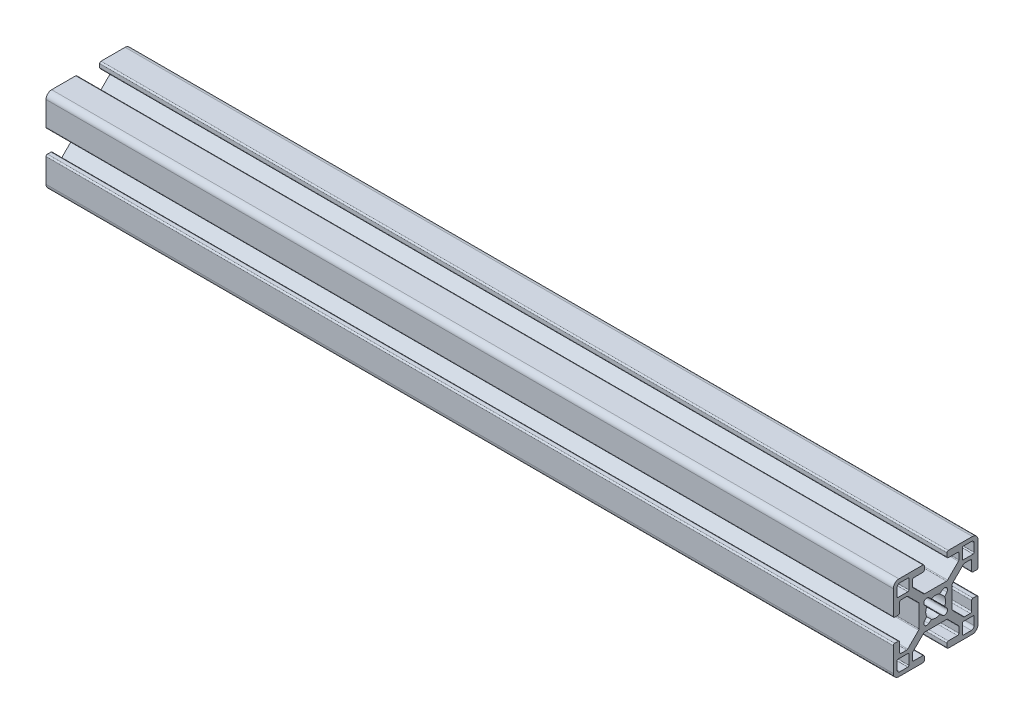
from build123d import *

# Parameters (mm, degrees)
PERFIL_COM_ALUMINIO_PERFIL_COMER_30_X_DEPTH = 300


with BuildPart() as part:
    # Esboço11 → Perfil com. aluminio PERFIL COMER. 30 X 30(1) (new body)
    with BuildSketch(Plane(origin=(0, 0, 0), x_dir=(0, 0, -1), z_dir=(1, 0, 0))):
        with BuildLine():
            Line((0, 5.872725395), (-3.872893219, 5.872725395))
            ThreePointArc((-3.872893219, 5.872725395), (-4.064234935, 5.910785628), (-4.226446609, 6.019172004))
            Line((-4.226446609, 6.019172004), (-8.073553391, 9.866278785))
            ThreePointArc((-8.073553391, 9.866278785), (-8.181939766, 10.02849046), (-8.22, 10.219832176))
            Line((-8.22, 10.219832176), (-8.22, 12.25))
            ThreePointArc((-8.22, 12.25), (-8.073553391, 12.603553391), (-7.72, 12.75))
            Line((-7.72, 12.75), (-4.5, 12.75))
            ThreePointArc((-4.5, 12.75), (-4.146446609, 12.896446609), (-4, 13.25))
            Line((-4, 13.25), (-4, 14.5))
            ThreePointArc((-4, 14.5), (-4.146446609, 14.853553391), (-4.5, 15))
            Line((-4.5, 15), (-13, 15))
            ThreePointArc((-13, 15), (-14.414213562, 14.414213562), (-15, 13))
            Line((-15, 13), (-15, 4.5))
            ThreePointArc((-15, 4.5), (-14.853553391, 4.146446609), (-14.5, 4))
            Line((-14.5, 4), (-13.25, 4))
            ThreePointArc((-13.25, 4), (-12.896446609, 4.146446609), (-12.75, 4.5))
            Line((-12.75, 4.5), (-12.75, 7.72))
            ThreePointArc((-12.75, 7.72), (-12.603553391, 8.073553391), (-12.25, 8.22))
            Line((-12.25, 8.22), (-10.219832176, 8.22))
            ThreePointArc((-10.219832176, 8.22), (-10.02849046, 8.181939766), (-9.866278785, 8.073553391))
            Line((-9.866278785, 8.073553391), (-6.019172004, 4.226446609))
            ThreePointArc((-6.019172004, 4.226446609), (-5.910785628, 4.064234935), (-5.872725395, 3.872893219))
            Line((-5.872725395, 3.872893219), (-5.872725395, 0))
            Line((-5.872725395, 0), (-5.872725395, -3.872893219))
            ThreePointArc((-5.872725395, -3.872893219), (-5.910785628, -4.064234935), (-6.019172004, -4.226446609))
            Line((-6.019172004, -4.226446609), (-9.866278785, -8.073553391))
            ThreePointArc((-9.866278785, -8.073553391), (-10.02849046, -8.181939766), (-10.219832176, -8.22))
            Line((-10.219832176, -8.22), (-12.25, -8.22))
            ThreePointArc((-12.25, -8.22), (-12.603553391, -8.073553391), (-12.75, -7.72))
            Line((-12.75, -7.72), (-12.75, -4.5))
            ThreePointArc((-12.75, -4.5), (-12.896446609, -4.146446609), (-13.25, -4))
            Line((-13.25, -4), (-14.5, -4))
            ThreePointArc((-14.5, -4), (-14.853553391, -4.146446609), (-15, -4.5))
            Line((-15, -4.5), (-15, -13))
            ThreePointArc((-15, -13), (-14.414213562, -14.414213562), (-13, -15))
            Line((-13, -15), (-4.5, -15))
            ThreePointArc((-4.5, -15), (-4.146446609, -14.853553391), (-4, -14.5))
            Line((-4, -14.5), (-4, -13.25))
            ThreePointArc((-4, -13.25), (-4.146446609, -12.896446609), (-4.5, -12.75))
            Line((-4.5, -12.75), (-7.72, -12.75))
            ThreePointArc((-7.72, -12.75), (-8.073553391, -12.603553391), (-8.22, -12.25))
            Line((-8.22, -12.25), (-8.22, -10.219832176))
            ThreePointArc((-8.22, -10.219832176), (-8.181939766, -10.02849046), (-8.073553391, -9.866278785))
            Line((-8.073553391, -9.866278785), (-4.226446609, -6.019172004))
            ThreePointArc((-4.226446609, -6.019172004), (-4.064234935, -5.910785628), (-3.872893219, -5.872725395))
            Line((-3.872893219, -5.872725395), (0, -5.872725395))
            Line((0, -5.872725395), (3.872893219, -5.872725395))
            ThreePointArc((3.872893219, -5.872725395), (4.064234935, -5.910785628), (4.226446609, -6.019172004))
            Line((4.226446609, -6.019172004), (8.073553391, -9.866278785))
            ThreePointArc((8.073553391, -9.866278785), (8.181939766, -10.02849046), (8.22, -10.219832176))
            Line((8.22, -10.219832176), (8.22, -12.25))
            ThreePointArc((8.22, -12.25), (8.073553391, -12.603553391), (7.72, -12.75))
            Line((7.72, -12.75), (4.5, -12.75))
            ThreePointArc((4.5, -12.75), (4.146446609, -12.896446609), (4, -13.25))
            Line((4, -13.25), (4, -14.5))
            ThreePointArc((4, -14.5), (4.146446609, -14.853553391), (4.5, -15))
            Line((4.5, -15), (13, -15))
            ThreePointArc((13, -15), (14.414213562, -14.414213562), (15, -13))
            Line((15, -13), (15, -4.5))
            ThreePointArc((15, -4.5), (14.853553391, -4.146446609), (14.5, -4))
            Line((14.5, -4), (13.25, -4))
            ThreePointArc((13.25, -4), (12.896446609, -4.146446609), (12.75, -4.5))
            Line((12.75, -4.5), (12.75, -7.72))
            ThreePointArc((12.75, -7.72), (12.603553391, -8.073553391), (12.25, -8.22))
            Line((12.25, -8.22), (10.219832176, -8.22))
            ThreePointArc((10.219832176, -8.22), (10.02849046, -8.181939766), (9.866278785, -8.073553391))
            Line((9.866278785, -8.073553391), (6.019172004, -4.226446609))
            ThreePointArc((6.019172004, -4.226446609), (5.910785628, -4.064234935), (5.872725395, -3.872893219))
            Line((5.872725395, -3.872893219), (5.872725395, 0))
            Line((5.872725395, 0), (5.872725395, 3.872893219))
            ThreePointArc((5.872725395, 3.872893219), (5.910785628, 4.064234935), (6.019172004, 4.226446609))
            Line((6.019172004, 4.226446609), (9.866278785, 8.073553391))
            ThreePointArc((9.866278785, 8.073553391), (10.02849046, 8.181939766), (10.219832176, 8.22))
            Line((10.219832176, 8.22), (12.25, 8.22))
            ThreePointArc((12.25, 8.22), (12.603553391, 8.073553391), (12.75, 7.72))
            Line((12.75, 7.72), (12.75, 4.5))
            ThreePointArc((12.75, 4.5), (12.896446609, 4.146446609), (13.25, 4))
            Line((13.25, 4), (14.5, 4))
            ThreePointArc((14.5, 4), (14.853553391, 4.146446609), (15, 4.5))
            Line((15, 4.5), (15, 13))
            ThreePointArc((15, 13), (14.414213562, 14.414213562), (13, 15))
            Line((13, 15), (4.5, 15))
            ThreePointArc((4.5, 15), (4.146446609, 14.853553391), (4, 14.5))
            Line((4, 14.5), (4, 13.25))
            ThreePointArc((4, 13.25), (4.146446609, 12.896446609), (4.5, 12.75))
            Line((4.5, 12.75), (7.72, 12.75))
            ThreePointArc((7.72, 12.75), (8.073553391, 12.603553391), (8.22, 12.25))
            Line((8.22, 12.25), (8.22, 10.219832176))
            ThreePointArc((8.22, 10.219832176), (8.181939766, 10.02849046), (8.073553391, 9.866278785))
            Line((8.073553391, 9.866278785), (4.226446609, 6.019172004))
            ThreePointArc((4.226446609, 6.019172004), (4.064234935, 5.910785628), (3.872893219, 5.872725395))
            Line((3.872893219, 5.872725395), (0, 5.872725395))
        make_face()
        with BuildLine():
            Line((-3.184880901, 1.488031663), (-3.963428513, 2.463089414))
            ThreePointArc((-3.963428513, 2.463089414), (-3.884059168, 3.884060272), (-2.463088278, 3.963429044))
            Line((-2.463088278, 3.963429044), (-1.488030527, 3.184881432))
            ThreePointArc((-1.488030527, 3.184881432), (-0.762142415, 3.431740597), (6.27e-07, 3.515352697))
            ThreePointArc((6.27e-07, 3.515352697), (0.762143639, 3.431740325), (1.488031663, 3.184880901))
            Line((1.488031663, 3.184880901), (2.463089414, 3.963428513))
            ThreePointArc((2.463089414, 3.963428513), (3.884060272, 3.884059168), (3.963429044, 2.463088278))
            Line((3.963429044, 2.463088278), (3.184881432, 1.488030527))
            ThreePointArc((3.184881432, 1.488030527), (3.431740597, 0.762142415), (3.515352697, -6.27e-07))
            ThreePointArc((3.515352697, -6.27e-07), (3.431740325, -0.762143639), (3.184880901, -1.488031663))
            Line((3.184880901, -1.488031663), (3.963428513, -2.463089414))
            ThreePointArc((3.963428513, -2.463089414), (3.884059168, -3.884060272), (2.463088278, -3.963429044))
            Line((2.463088278, -3.963429044), (1.488030527, -3.184881432))
            ThreePointArc((1.488030527, -3.184881432), (0.762142415, -3.431740597), (-6.27e-07, -3.515352697))
            ThreePointArc((-6.27e-07, -3.515352697), (-0.762143639, -3.431740325), (-1.488031663, -3.184880901))
            Line((-1.488031663, -3.184880901), (-2.463089414, -3.963428513))
            ThreePointArc((-2.463089414, -3.963428513), (-3.884060272, -3.884059168), (-3.963429044, -2.463088278))
            Line((-3.963429044, -2.463088278), (-3.184881432, -1.488030527))
            ThreePointArc((-3.184881432, -1.488030527), (-3.431740597, -0.762142415), (-3.515352697, 6.27e-07))
            ThreePointArc((-3.515352697, 6.27e-07), (-3.431740325, 0.762143639), (-3.184880901, 1.488031663))
        make_face(mode=Mode.SUBTRACT)
        with BuildLine():
            Line((-9.46, 13.26), (-9.46, 9.84))
            ThreePointArc((-9.46, 9.84), (-9.571299423, 9.571299423), (-9.84, 9.46))
            Line((-9.84, 9.46), (-13.26, 9.46))
            ThreePointArc((-13.26, 9.46), (-13.528700577, 9.571299423), (-13.64, 9.84))
            Line((-13.64, 9.84), (-13.64, 12.64))
            ThreePointArc((-13.64, 12.64), (-13.347106781, 13.347106781), (-12.64, 13.64))
            Line((-12.64, 13.64), (-9.84, 13.64))
            ThreePointArc((-9.84, 13.64), (-9.571299423, 13.528700577), (-9.46, 13.26))
        make_face(mode=Mode.SUBTRACT)
        with BuildLine():
            Line((13.64, 12.64), (13.64, 9.84))
            ThreePointArc((13.64, 9.84), (13.528700577, 9.571299423), (13.26, 9.46))
            Line((13.26, 9.46), (9.84, 9.46))
            ThreePointArc((9.84, 9.46), (9.571299423, 9.571299423), (9.46, 9.84))
            Line((9.46, 9.84), (9.46, 13.26))
            ThreePointArc((9.46, 13.26), (9.571299423, 13.528700577), (9.84, 13.64))
            Line((9.84, 13.64), (12.64, 13.64))
            ThreePointArc((12.64, 13.64), (13.347106781, 13.347106781), (13.64, 12.64))
        make_face(mode=Mode.SUBTRACT)
        with BuildLine():
            Line((12.64, -13.64), (9.84, -13.64))
            ThreePointArc((9.84, -13.64), (9.571299423, -13.528700577), (9.46, -13.26))
            Line((9.46, -13.26), (9.46, -9.84))
            ThreePointArc((9.46, -9.84), (9.571299423, -9.571299423), (9.84, -9.46))
            Line((9.84, -9.46), (13.26, -9.46))
            ThreePointArc((13.26, -9.46), (13.528700577, -9.571299423), (13.64, -9.84))
            Line((13.64, -9.84), (13.64, -12.64))
            ThreePointArc((13.64, -12.64), (13.347106781, -13.347106781), (12.64, -13.64))
        make_face(mode=Mode.SUBTRACT)
        with BuildLine():
            Line((-13.64, -12.64), (-13.64, -9.84))
            ThreePointArc((-13.64, -9.84), (-13.528700577, -9.571299423), (-13.26, -9.46))
            Line((-13.26, -9.46), (-9.84, -9.46))
            ThreePointArc((-9.84, -9.46), (-9.571299423, -9.571299423), (-9.46, -9.84))
            Line((-9.46, -9.84), (-9.46, -13.26))
            ThreePointArc((-9.46, -13.26), (-9.571299423, -13.528700577), (-9.84, -13.64))
            Line((-9.84, -13.64), (-12.64, -13.64))
            ThreePointArc((-12.64, -13.64), (-13.347106781, -13.347106781), (-13.64, -12.64))
        make_face(mode=Mode.SUBTRACT)
    extrude(amount=PERFIL_COM_ALUMINIO_PERFIL_COMER_30_X_DEPTH)


solid = part.part
